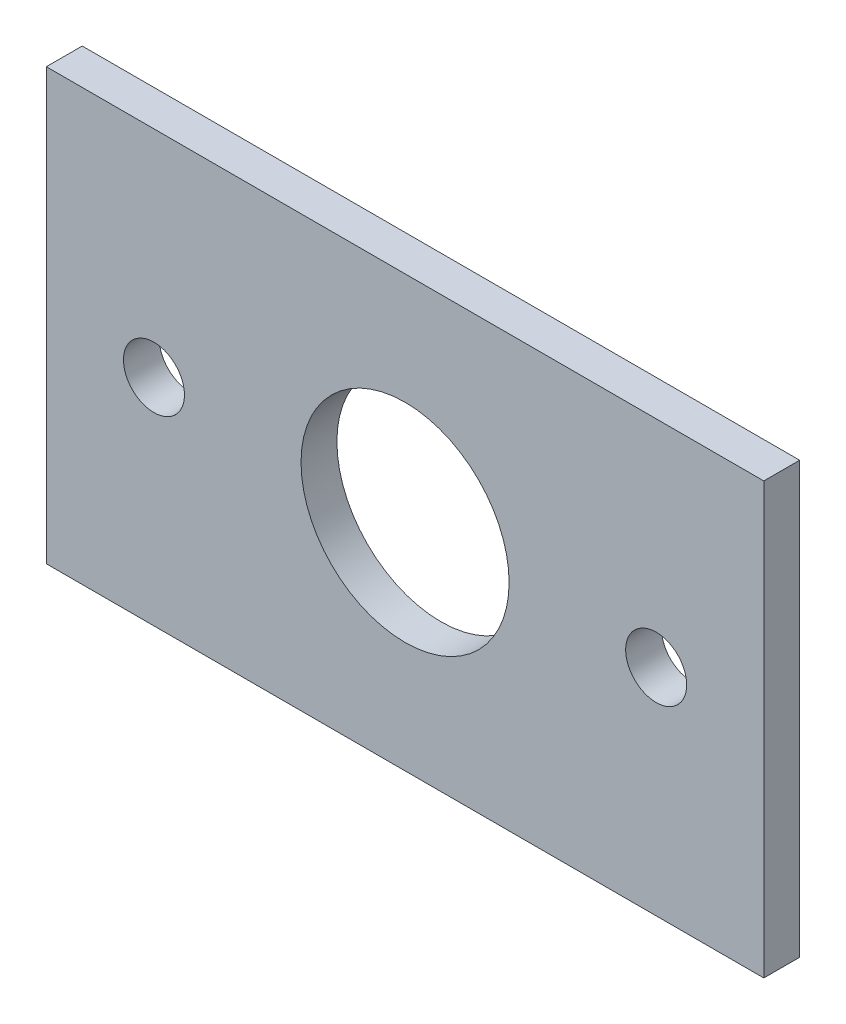
from build123d import *

# Parameters (mm, degrees)
SKETCH_1_W                     = 40
SKETCH_1_H                     = 24
SKETCH_1_R                     = 5.8
SKETCH_1_R_2                   = 1.7
BEARING_RETAINER_40X24X2_DEPTH = 2


with BuildPart() as part:
    # 草图1 → Bearing_retainer_40x24x2 (new body)
    with BuildSketch(Plane.XY):
        Rectangle(SKETCH_1_W, SKETCH_1_H)
        Circle(SKETCH_1_R, mode=Mode.SUBTRACT)
        with Locations((-14, 0)):
            Circle(SKETCH_1_R_2, mode=Mode.SUBTRACT)
        with Locations((14, 0)):
            Circle(SKETCH_1_R_2, mode=Mode.SUBTRACT)
    extrude(amount=BEARING_RETAINER_40X24X2_DEPTH)


solid = part.part
